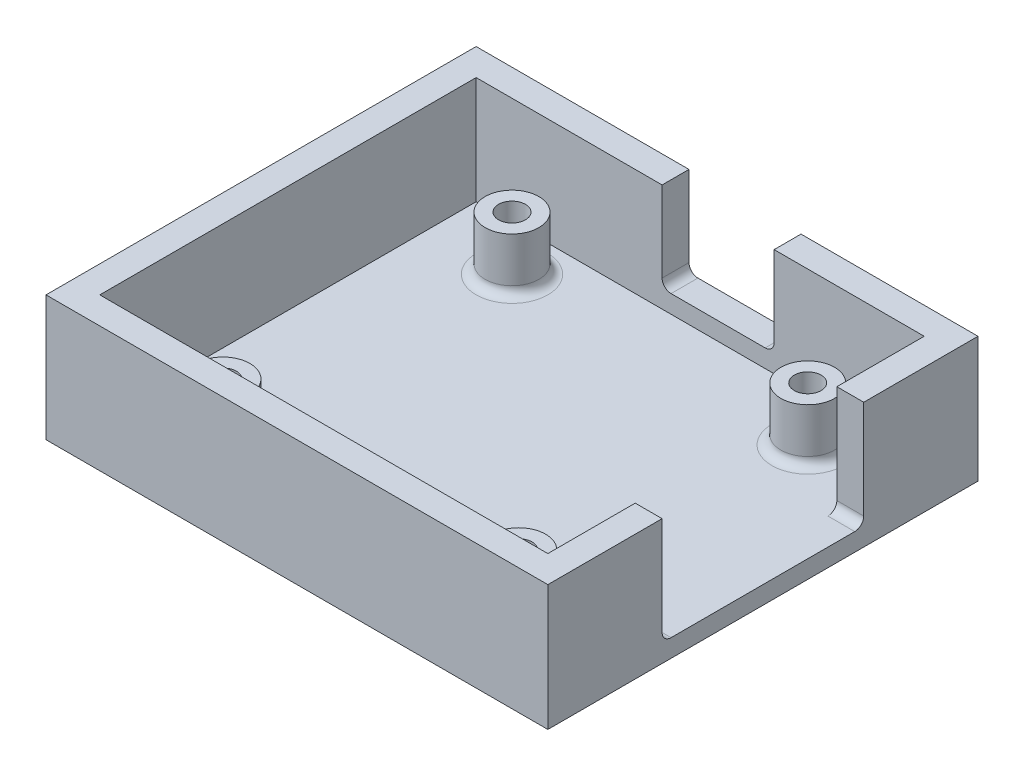
from build123d import *

# Parameters (mm, degrees)
SKETCH1_W           = 56
SKETCH1_H           = 48
BOSS_EXTRUDE1_DEPTH = 14
SKETCH3_W           = 50
SKETCH3_H           = 42
CUT_EXTRUDE1_DEPTH  = 12
SKETCH4_R           = 3
SKETCH4_R_2         = 1.5
BOSS_EXTRUDE2_DEPTH = 6
SKETCH5_W           = 22.5
SKETCH5_H           = 12
CUT_EXTRUDE2_DEPTH  = 3
SKETCH6_W           = 12.5
SKETCH6_H           = 10
CUT_EXTRUDE3_DEPTH  = 3
FILLET1_R           = 1
FILLET2_R           = 1


with BuildPart() as part:
    # Sketch1 → Boss-Extrude1 (new body)
    with BuildSketch(Plane(origin=(0, 0, 0), x_dir=(1, 0, 0), z_dir=(0, 1, 0))):
        with Locations((7.929648241, -0.507537688)):
            Rectangle(SKETCH1_W, SKETCH1_H)
    extrude(amount=BOSS_EXTRUDE1_DEPTH)

    # Sketch3 → Cut-Extrude1 (cut)
    with BuildSketch(Plane(origin=(0, 14, 0), x_dir=(1, 0, 0), z_dir=(0, 1, 0))):
        with Locations((7.929648241, -0.507537688)):
            Rectangle(SKETCH3_W, SKETCH3_H)
    extrude(amount=-CUT_EXTRUDE1_DEPTH, mode=Mode.SUBTRACT)

    # Sketch4 → Boss-Extrude2 (add)
    # profile 1 of 4: a face of its own
    with BuildSketch(Plane(origin=(0, 2, 0), x_dir=(1, 0, 0), z_dir=(0, 1, 0))):
        with Locations(Location((-8.070351759, 15.492462312, 0), (0, 0, 270))):
            Circle(SKETCH4_R)
        with Locations(Location((-8.070351759, 15.492462312, 0), (0, 0, 270))):
            Circle(SKETCH4_R_2, mode=Mode.SUBTRACT)
    # profile 2 of 4: a face of its own
    with BuildSketch(Plane(origin=(0, 2, 0), x_dir=(1, 0, 0), z_dir=(0, 1, 0))):
        with Locations(Location((24.929648241, 15.492462312, 0), (0, 0, 270))):
            Circle(SKETCH4_R)
        with Locations(Location((24.929648241, 15.492462312, 0), (0, 0, 270))):
            Circle(SKETCH4_R_2, mode=Mode.SUBTRACT)
    # profile 3 of 4: a face of its own
    with BuildSketch(Plane(origin=(0, 2, 0), x_dir=(1, 0, 0), z_dir=(0, 1, 0))):
        with Locations(Location((24.929648241, -16.757537688, 0), (0, 0, 270))):
            Circle(SKETCH4_R)
        with Locations(Location((24.929648241, -16.757537688, 0), (0, 0, 270))):
            Circle(SKETCH4_R_2, mode=Mode.SUBTRACT)
    # profile 4 of 4: a face of its own
    with BuildSketch(Plane(origin=(0, 2, 0), x_dir=(1, 0, 0), z_dir=(0, 1, 0))):
        with Locations(Location((-8.070351759, -16.757537688, 0), (0, 0, 270))):
            Circle(SKETCH4_R)
        with Locations(Location((-8.070351759, -16.757537688, 0), (0, 0, 270))):
            Circle(SKETCH4_R_2, mode=Mode.SUBTRACT)
    extrude(amount=BOSS_EXTRUDE2_DEPTH)

    # Sketch5 → Cut-Extrude2 (cut)
    with BuildSketch(Plane.ZY.offset(-32.929648241)):
        with Locations((0.507537688, 8)):
            Rectangle(SKETCH5_W, SKETCH5_H)
    extrude(amount=-CUT_EXTRUDE2_DEPTH, mode=Mode.SUBTRACT)

    # Sketch6 → Cut-Extrude3 (cut)
    with BuildSketch(Plane.XY.offset(-20.492462312)):
        with Locations((9.929648241, 9)):
            Rectangle(SKETCH6_W, SKETCH6_H)
    extrude(amount=-CUT_EXTRUDE3_DEPTH, mode=Mode.SUBTRACT)

    # Fillet1
    fillet1_edges = [part.edges().sort_by_distance(p)[0] for p in [
        (34.429648241, 2, -10.742462312),
        (34.429648241, 2, 11.757537688),
        (3.679648241, 4, -21.992462312),
        (16.179648241, 4, -21.992462312),
    ]]
    fillet(fillet1_edges, radius=FILLET1_R)

    # Fillet2
    fillet2_edges = [part.edges().sort_by_distance(p)[0] for p in [
        (-8.070351759, 2, -18.492462312),
        (24.929648241, 2, -18.492462312),
        (24.929648241, 2, 13.757537688),
        (-8.070351759, 2, 13.757537688),
    ]]
    fillet(fillet2_edges, radius=FILLET2_R)


solid = part.part
